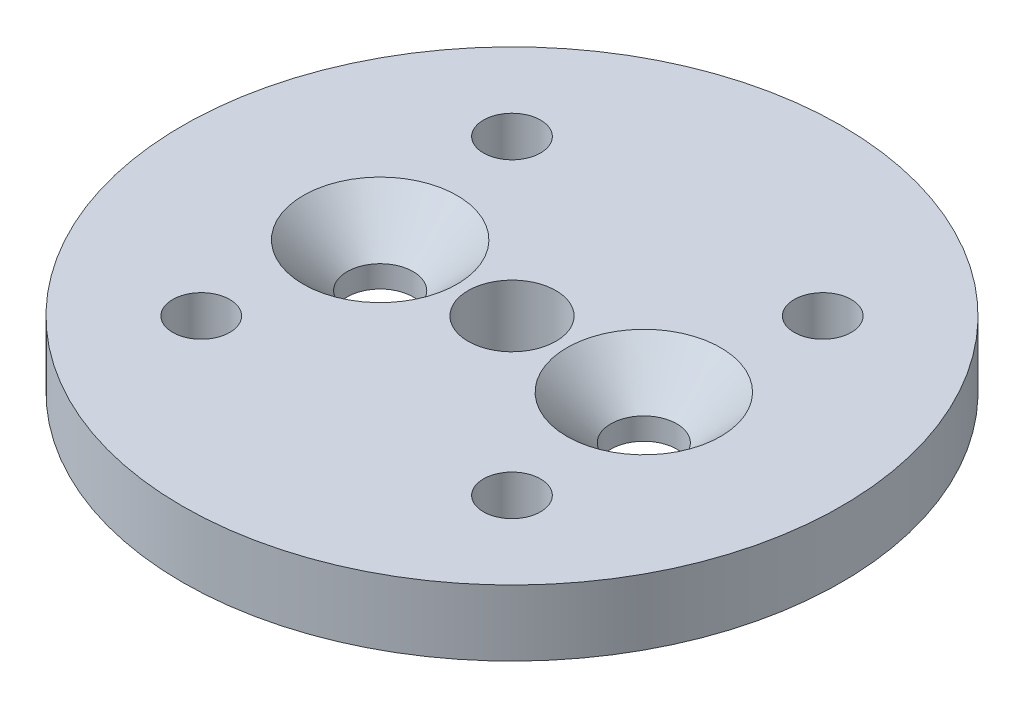
from build123d import *

# Parameters (mm, degrees)
SKETCH1_R           = 15
SKETCH1_R_2         = 2
BOSS_EXTRUDE1_DEPTH = 3
SKETCH2_R           = 1.5
CUT_EXTRUDE1_DEPTH  = 3
CHAMFER1_SIZE       = 2
SKETCH3_R           = 1.3
CUT_EXTRUDE2_DEPTH  = 3


with BuildPart() as part:
    # Sketch1 → Boss-Extrude1 (new body)
    with BuildSketch(Plane(origin=(0, 0, 0), x_dir=(1, 0, 0), z_dir=(0, 1, 0))):
        with Locations(Location((0, 0, 0), (0, 0, 270))):
            Circle(SKETCH1_R)
        with Locations(Location((0, 0, 0), (0, 0, 270))):
            Circle(SKETCH1_R_2, mode=Mode.SUBTRACT)
    extrude(amount=BOSS_EXTRUDE1_DEPTH)

    # Sketch2 → Cut-Extrude1 (cut)
    with BuildSketch(Plane(origin=(0, 3, 0), x_dir=(1, 0, 0), z_dir=(0, 1, 0))):
        with Locations(Location((6, 0, 0), (0, 0, 270))):
            Circle(SKETCH2_R)
        with Locations(Location((-6, 0, 0), (0, 0, 270))):
            Circle(SKETCH2_R)
    extrude(amount=-CUT_EXTRUDE1_DEPTH, mode=Mode.SUBTRACT)

    # Chamfer1
    chamfer1_edges = [part.edges().sort_by_distance(p)[0] for p in [
        (6, 3, -1.5),
        (-6, 3, -1.5),
    ]]
    chamfer(chamfer1_edges, length=CHAMFER1_SIZE)

    # Sketch3 → Cut-Extrude2 (cut)
    with BuildSketch(Plane(origin=(0, 3, 0), x_dir=(1, 0, 0), z_dir=(0, 1, 0))):
        with Locations(Location((-7.072135785, 7.072135785, 0), (0, 0, 270))):
            Circle(SKETCH3_R)
        with Locations(Location((7.072135785, 7.072135785, 0), (0, 0, 270))):
            Circle(SKETCH3_R)
        with Locations(Location((7.072135785, -7.072135785, 0), (0, 0, 270))):
            Circle(SKETCH3_R)
        with Locations(Location((-7.072135785, -7.072135785, 0), (0, 0, 270))):
            Circle(SKETCH3_R)
    extrude(amount=-CUT_EXTRUDE2_DEPTH, mode=Mode.SUBTRACT)


solid = part.part
